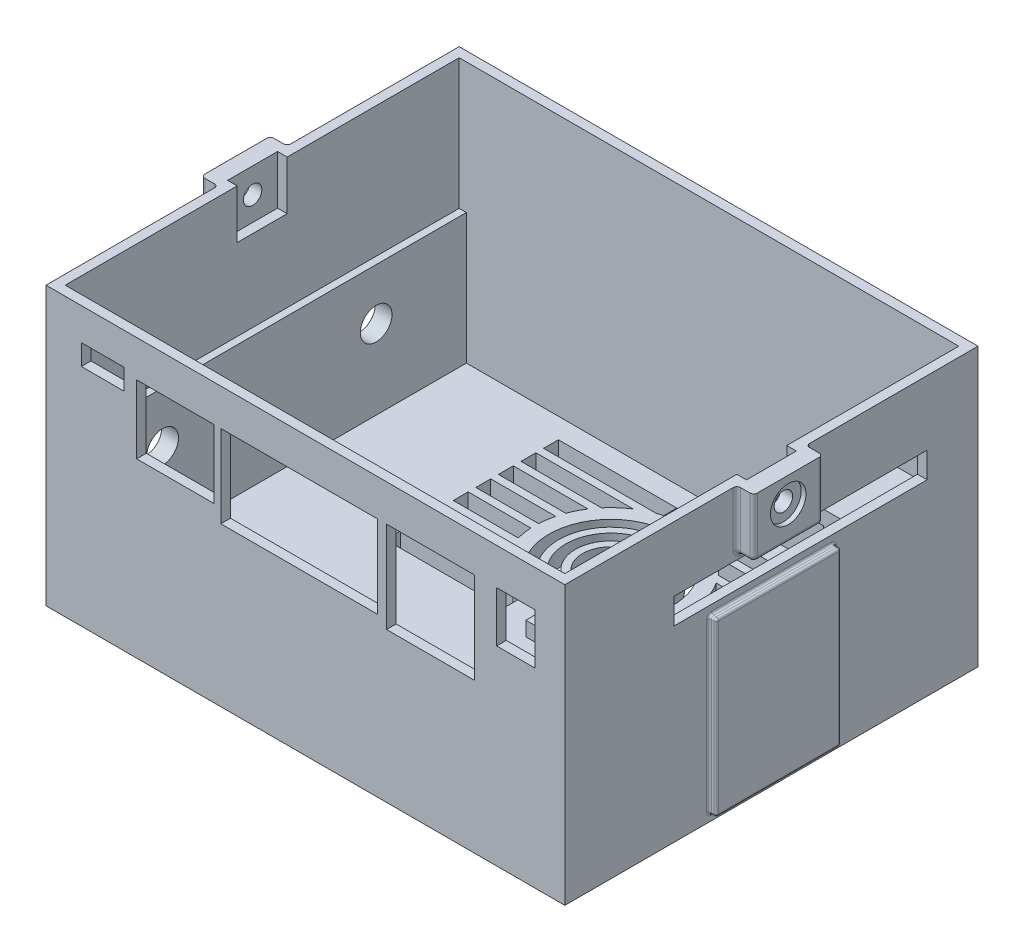
from build123d import *

# Parameters (mm, degrees)
SKETCH1_W                 = 108
SKETCH1_H                 = 86
BOSS_EXTRUDE1_DEPTH       = 1.5
SKETCH2_W                 = 108
SKETCH2_H                 = 86
BOSS_EXTRUDE2_DEPTH       = 56.3
SHELL1_T                  = -2
SHELL1_THICKNESS_2_FACE_W = 82
SHELL1_THICKNESS_2_FACE_H = 104
SHELL1_THICKNESS_2_DEPTH  = 1.5
SKETCH3_W                 = 10.4
SKETCH3_H                 = 10.2125
CUT_EXTRUDE1_DEPTH        = 130.822340142
SKETCH4_W                 = 14.4
SKETCH4_H                 = 12.2125
BOSS_EXTRUDE3_DEPTH       = 3.5
SKETCH5_R                 = 1.925
CUT_EXTRUDE2_DEPTH        = 136.701289603
FILLET1_R                 = 0.75
FILLET2_R                 = 0.75
FILLET3_R                 = 0.75
FILLET4_R                 = 0.75
FILLET5_R                 = 0.75
FILLET6_R                 = 0.75
FILLET7_R                 = 0.75
FILLET8_R                 = 0.75
SKETCH6_W                 = 22
SKETCH6_H                 = 31.76
CUT_EXTRUDE3_DEPTH        = 1.5
SKETCH7_W                 = 26
SKETCH7_H                 = 35.76
BOSS_EXTRUDE4_DEPTH       = 1.5
FILLET9_R                 = 0.5
FILLET10_R                = 0.5
FILLET11_R                = 0.5
FILLET12_R                = 0.5
FILLET13_R                = 0.5
CUT_EXTRUDE4_REACH        = 134.748
SKETCH8_R                 = 3.3
SKETCH9_R                 = 7.7
CUT_EXTRUDE5_DEPTH        = 1.5
SKETCH10_R                = 1
CUT_EXTRUDE7_DEPTH        = 3.5
CHAMFER1_SIZE             = 1.2
CUT_EXTRUDE14_REACH       = 134.748
SKETCH14_W                = 52.66718309
SKETCH14_H                = 5.352161992
SKETCH15_R                = 3.7
CUT_EXTRUDE15_DEPTH       = 1
SKETCH16_W                = 15.24
SKETCH16_H                = 3
BOSS_EXTRUDE5_DEPTH       = 16
SKETCH17_W                = 5
SKETCH17_H                = 15.24
BOSS_EXTRUDE6_DEPTH       = 5
SKETCH19_W                = 82
SKETCH19_H                = 27.15
BOSS_EXTRUDE7_DEPTH       = 1.5
CUT_EXTRUDE16_REACH       = 86.179
SKETCH20_W                = 5.5
SKETCH20_H                = 15.24
CHAMFER2_SIZE             = 1
SKETCH21_W                = 2.5
SKETCH21_H                = 7.5
BOSS_EXTRUDE8_DEPTH       = 2
CHAMFER3_SIZE             = 0.75
CUT_EXTRUDE17_REACH       = 120.504
SKETCH22_W                = 8
SKETCH22_H                = 10.5
SKETCH22_W_2              = 8.895326338
SKETCH22_H_2              = 4.310523948
SKETCH22_W_3              = 16.064987835
SKETCH22_H_3              = 14.242562804
SKETCH22_W_4              = 32.602638297
SKETCH22_H_4              = 17.185035412
SKETCH22_W_5              = 18.335686492
SKETCH22_H_5              = 18.996886161
CUT_EXTRUDE18_REACH       = 94.174
CUT_EXTRUDE19_REACH       = 133.073
SKETCH24_R                = 3.3


with BuildPart() as part:
    # Sketch1 → Boss-Extrude1 (new body)
    with BuildSketch(Plane(origin=(0, 0, 0), x_dir=(1, 0, 0), z_dir=(0, 1, 0))):
        Rectangle(SKETCH1_W, SKETCH1_H)
    extrude(amount=BOSS_EXTRUDE1_DEPTH)

    # Sketch2 → Boss-Extrude2 (add)
    with BuildSketch(Plane(origin=(0, 1.5, 0), x_dir=(1, 0, 0), z_dir=(0, 1, 0))):
        Rectangle(SKETCH2_W, SKETCH2_H)
    extrude(amount=BOSS_EXTRUDE2_DEPTH)

    # Shell1
    shell1_openings = [part.faces().sort_by_distance(p)[0] for p in [
        (0, 57.8, 0),
    ]]
    offset(amount=SHELL1_T, openings=shell1_openings, kind=Kind.INTERSECTION)

    # Shell1 thickness 2 face (on inner face of the shell) → Shell1 thickness 2 (add)
    with BuildSketch(Plane(origin=(0, 2, 0), x_dir=(0, 0, -1), z_dir=(0, -1, 0))):
        Rectangle(SHELL1_THICKNESS_2_FACE_W, SHELL1_THICKNESS_2_FACE_H)
    extrude(amount=-SHELL1_THICKNESS_2_DEPTH)

    # Sketch3 → Cut-Extrude1 (cut, through all)
    with BuildSketch(Plane(origin=(54, 0, 0), x_dir=(0, 0, -1), z_dir=(1, 0, 0))):
        with Locations((0, 52.69375)):
            Rectangle(SKETCH3_W, SKETCH3_H)
    extrude(amount=-CUT_EXTRUDE1_DEPTH, mode=Mode.SUBTRACT)

    # Sketch4 → Boss-Extrude3 (add)
    with BuildSketch(Plane(origin=(54, 0, 0), x_dir=(0, 0, -1), z_dir=(1, 0, 0))):
        with Locations((0, 51.69375)):
            Rectangle(SKETCH4_W, SKETCH4_H)
    boss_extrude3 = extrude(amount=BOSS_EXTRUDE3_DEPTH)

    # Mirror1: Boss-Extrude3 across plane
    add(boss_extrude3.mirror(Plane(origin=(0, 0, 0), x_dir=(0, 0, 1), z_dir=(1, 0, 0))))

    # Sketch5 → Cut-Extrude2 (cut, through all)
    with BuildSketch(Plane(origin=(57.5, 0, 0), x_dir=(0, 0, -1), z_dir=(1, 0, 0))):
        with Locations((0, 52.5875)):
            Circle(SKETCH5_R)
    extrude(amount=-CUT_EXTRUDE2_DEPTH, mode=Mode.SUBTRACT)

    # Fillet1
    fillet1_edges = [part.edges().sort_by_distance(p)[0] for p in [
        (57.5, 51.69375, 7.2),
    ]]
    fillet(fillet1_edges, radius=FILLET1_R)

    # Fillet2
    fillet2_edges = [part.edges().sort_by_distance(p)[0] for p in [
        (55.375, 45.5875, 7.2),
        (57.5, 45.5875, -0.375),
        (57.280330086, 45.5875, 6.980330086),
    ]]
    fillet(fillet2_edges, radius=FILLET2_R)

    # Fillet3
    fillet3_edges = [part.edges().sort_by_distance(p)[0] for p in [
        (55.375, 45.5875, -7.2),
        (57.5, 52.06875, -7.2),
        (57.280330086, 45.807169914, -7.2),
    ]]
    fillet(fillet3_edges, radius=FILLET3_R)

    # Fillet4
    fillet4_edges = [part.edges().sort_by_distance(p)[0] for p in [
        (54, 45.5875, 0),
        (54, 45.807169914, 6.980330086),
        (54, 52.06875, -7.2),
        (54, 45.807169914, -6.980330086),
        (54, 52.06875, 7.2),
    ]]
    fillet(fillet4_edges, radius=FILLET4_R)

    # Fillet5
    fillet5_edges = [part.edges().sort_by_distance(p)[0] for p in [
        (-57.5, 51.69375, -7.2),
    ]]
    fillet(fillet5_edges, radius=FILLET5_R)

    # Fillet6
    fillet6_edges = [part.edges().sort_by_distance(p)[0] for p in [
        (-55.375, 45.5875, -7.2),
        (-57.280330086, 45.5875, -6.980330086),
        (-57.5, 45.5875, 0.375),
    ]]
    fillet(fillet6_edges, radius=FILLET6_R)

    # Fillet7
    fillet7_edges = [part.edges().sort_by_distance(p)[0] for p in [
        (-55.375, 45.5875, 7.2),
        (-57.280330086, 45.807169914, 7.2),
        (-57.5, 52.06875, 7.2),
    ]]
    fillet(fillet7_edges, radius=FILLET7_R)

    # Fillet8
    fillet8_edges = [part.edges().sort_by_distance(p)[0] for p in [
        (-54, 52.06875, -7.2),
        (-54, 45.807169914, -6.980330086),
        (-54, 45.5875, 0),
        (-54, 45.807169914, 6.980330086),
        (-54, 52.06875, 7.2),
    ]]
    fillet(fillet8_edges, radius=FILLET8_R)

    # Sketch6 → Cut-Extrude3 (cut)
    with BuildSketch(Plane.ZY.offset(-52)):
        with Locations((0, 19.38)):
            Rectangle(SKETCH6_W, SKETCH6_H)
    extrude(amount=-CUT_EXTRUDE3_DEPTH, mode=Mode.SUBTRACT)

    # Sketch7 → Boss-Extrude4 (add)
    with BuildSketch(Plane(origin=(54, 0, 0), x_dir=(0, 0, -1), z_dir=(1, 0, 0))):
        with Locations((0, 19.38)):
            Rectangle(SKETCH7_W, SKETCH7_H)
    extrude(amount=BOSS_EXTRUDE4_DEPTH)

    # Fillet9
    fillet9_edges = [part.edges().sort_by_distance(p)[0] for p in [
        (55.5, 19.38, 13),
    ]]
    fillet(fillet9_edges, radius=FILLET9_R)

    # Fillet10
    fillet10_edges = [part.edges().sort_by_distance(p)[0] for p in [
        (54.5, 1.5, 13),
        (55.5, 1.5, -0.25),
        (55.353553391, 1.5, 12.853553391),
    ]]
    fillet(fillet10_edges, radius=FILLET10_R)

    # Fillet11
    fillet11_edges = [part.edges().sort_by_distance(p)[0] for p in [
        (54.5, 1.5, -13),
        (55.5, 19.63, -13),
        (55.353553391, 1.646446609, -13),
    ]]
    fillet(fillet11_edges, radius=FILLET11_R)

    # Fillet12
    fillet12_edges = [part.edges().sort_by_distance(p)[0] for p in [
        (54.5, 37.26, 13),
        (55.353553391, 37.26, 12.853553391),
        (54.5, 37.26, -13),
        (55.5, 37.26, 0),
        (55.353553391, 37.26, -12.853553391),
    ]]
    fillet(fillet12_edges, radius=FILLET12_R)

    # Fillet13
    fillet13_edges = [part.edges().sort_by_distance(p)[0] for p in [
        (54, 1.5, 0),
        (54, 1.646446609, 12.853553391),
        (54, 19.38, -13),
        (54, 1.646446609, -12.853553391),
        (54, 37.26, 0),
        (54, 19.38, 13),
        (54, 37.113553391, 12.853553391),
        (54, 37.113553391, -12.853553391),
    ]]
    fillet(fillet13_edges, radius=FILLET13_R)

    # Sketch8 → Cut-Extrude4 (cut, up to next)
    with BuildSketch(Plane.ZY.offset(54), mode=Mode.PRIVATE) as cut_extrude4_sk1:
        with Locations((-22.225, 20)):
            Circle(SKETCH8_R)
    cut_extrude4_tool1 = extrude(cut_extrude4_sk1.sketch, amount=-CUT_EXTRUDE4_REACH, mode=Mode.PRIVATE) & part.part
    # Sketch8 → Cut-Extrude4 (cut, up to next)
    with BuildSketch(Plane.ZY.offset(54), mode=Mode.PRIVATE) as cut_extrude4_sk2:
        with Locations((22.225, 20)):
            Circle(SKETCH8_R)
    cut_extrude4_tool2 = extrude(cut_extrude4_sk2.sketch, amount=-CUT_EXTRUDE4_REACH, mode=Mode.PRIVATE) & part.part
    add(cut_extrude4_tool1.solids().sort_by_distance((-54, 20, -22.225))[0], mode=Mode.SUBTRACT)
    add(cut_extrude4_tool2.solids().sort_by_distance((-54, 20, 22.225))[0], mode=Mode.SUBTRACT)

    # Sketch9 → Cut-Extrude5 (cut)
    with BuildSketch(Plane(origin=(0, 3.5, 0), x_dir=(1, 0, 0), z_dir=(0, 1, 0))):
        with Locations(Location((42.9999, 0, 0), (0, 0, 270))):
            Circle(SKETCH9_R)
    extrude(amount=-CUT_EXTRUDE5_DEPTH, mode=Mode.SUBTRACT)

    # Sketch10 → Cut-Extrude7 (cut)
    with BuildSketch(Plane.XZ):
        with Locations(Location((34.9999, -8, 0), (0, 0, 270))):
            Circle(SKETCH10_R)
        with Locations(Location((34.9999, 8, 0), (0, 0, 270))):
            Circle(SKETCH10_R)
        with Locations(Location((50.9999, 8, 0), (0, 0, 270))):
            Circle(SKETCH10_R)
        with Locations(Location((50.9999, -8, 0), (0, 0, 270))):
            Circle(SKETCH10_R)
    extrude(amount=-CUT_EXTRUDE7_DEPTH, mode=Mode.SUBTRACT)

    # Chamfer1
    chamfer1_edges = [part.edges().sort_by_distance(p)[0] for p in [
        (50.9999, 0, -7),
        (50.9999, 0, 9),
        (34.9999, 0, 9),
        (34.9999, 0, -7),
    ]]
    chamfer(chamfer1_edges, length=CHAMFER1_SIZE)

    # Sketch14 → Cut-Extrude14 (cut, up to next)
    with BuildSketch(Plane(origin=(54, 0, 0), x_dir=(0, 0, -1), z_dir=(1, 0, 0)), mode=Mode.PRIVATE) as cut_extrude14_sk1:
        with Locations((6.093499001, 41.681814934)):
            Rectangle(SKETCH14_W, SKETCH14_H)
    cut_extrude14_tool1 = extrude(cut_extrude14_sk1.sketch, amount=-CUT_EXTRUDE14_REACH, mode=Mode.PRIVATE) & part.part
    add(cut_extrude14_tool1.solids().sort_by_distance((54, 41.681815, -6.093499))[0], mode=Mode.SUBTRACT)

    # Sketch15 → Cut-Extrude15 (cut)
    with BuildSketch(Plane(origin=(57.5, 0, 0), x_dir=(0, 0, -1), z_dir=(1, 0, 0))):
        with Locations((0, 52.5875)):
            Circle(SKETCH15_R)
    cut_extrude15 = extrude(amount=-CUT_EXTRUDE15_DEPTH, mode=Mode.SUBTRACT)

    # Mirror2: Cut-Extrude15 across plane
    add(cut_extrude15.mirror(Plane(origin=(0, 0, 0), x_dir=(0, 0, 1), z_dir=(1, 0, 0))), mode=Mode.SUBTRACT)

    # Sketch16 → Boss-Extrude5 (add)
    with BuildSketch(Plane.ZY.offset(-52)):
        with Locations((-25.50005, 35.96)):
            Rectangle(SKETCH16_W, SKETCH16_H)
        with Locations((-25.50005, 12.358309837)):
            Rectangle(SKETCH16_W, SKETCH16_H)
        with Locations((25.50005, 12.358309837)):
            Rectangle(SKETCH16_W, SKETCH16_H)
        with Locations((25.50005, 35.96)):
            Rectangle(SKETCH16_W, SKETCH16_H)
    extrude(amount=BOSS_EXTRUDE5_DEPTH)

    # Sketch17 → Boss-Extrude6 (add)
    with BuildSketch(Plane(origin=(0, 13.858309837, 0), x_dir=(1, 0, 0), z_dir=(0, 1, 0))):
        with Locations((49.5, 25.50005)):
            Rectangle(SKETCH17_W, SKETCH17_H)
        with Locations((49.5, -25.50005)):
            Rectangle(SKETCH17_W, SKETCH17_H)
    boss_extrude6 = extrude(amount=BOSS_EXTRUDE6_DEPTH)

    # Mirror3: Boss-Extrude6 across plane
    add(boss_extrude6.mirror(Plane.ZX.offset(24.159154919)))

    # Sketch19 → Boss-Extrude7 (add)
    with BuildSketch(Plane(origin=(-52, 0, 0), x_dir=(0, 0, -1), z_dir=(1, 0, 0))):
        with Locations((0, 17.075)):
            Rectangle(SKETCH19_W, SKETCH19_H)
    extrude(amount=BOSS_EXTRUDE7_DEPTH)

    # Sketch20 → Cut-Extrude16 (cut, up to next)
    with BuildSketch(Plane(origin=(0, 13.858309837, 0), x_dir=(1, 0, 0), z_dir=(0, 1, 0)), mode=Mode.PRIVATE) as cut_extrude16_sk1:
        with Locations((38.75, -25.50005)):
            Rectangle(SKETCH20_W, SKETCH20_H)
    cut_extrude16_tool1 = extrude(cut_extrude16_sk1.sketch, amount=-CUT_EXTRUDE16_REACH, mode=Mode.PRIVATE) & part.part
    # Sketch20 → Cut-Extrude16 (cut, up to next)
    with BuildSketch(Plane(origin=(0, 13.858309837, 0), x_dir=(1, 0, 0), z_dir=(0, 1, 0)), mode=Mode.PRIVATE) as cut_extrude16_sk2:
        with Locations((38.75, 25.50005)):
            Rectangle(SKETCH20_W, SKETCH20_H)
    cut_extrude16_tool2 = extrude(cut_extrude16_sk2.sketch, amount=-CUT_EXTRUDE16_REACH, mode=Mode.PRIVATE) & part.part
    add(cut_extrude16_tool1.solids().sort_by_distance((38.75, 13.85831, 25.50005))[0], mode=Mode.SUBTRACT)
    add(cut_extrude16_tool2.solids().sort_by_distance((38.75, 13.85831, -25.50005))[0], mode=Mode.SUBTRACT)

    # Chamfer2
    chamfer2_edges = [part.edges().sort_by_distance(p)[0] for p in [
        (41.5, 13.858309837, 25.50005),
        (41.5, 13.858309837, -25.50005),
    ]]
    chamfer(chamfer2_edges, length=CHAMFER2_SIZE)

    # Sketch21 → Boss-Extrude8 (add)
    with BuildSketch(Plane.XZ.offset(-34.46)):
        with Locations((41.25, 25.552322756)):
            Rectangle(SKETCH21_W, SKETCH21_H)
        with Locations((41.25, -25.55005)):
            Rectangle(SKETCH21_W, SKETCH21_H)
    extrude(amount=BOSS_EXTRUDE8_DEPTH)

    # Chamfer3
    chamfer3_edges = [part.edges().sort_by_distance(p)[0] for p in [
        (42.5, 32.46, 25.552322756),
        (42.5, 32.46, -25.55005),
    ]]
    chamfer(chamfer3_edges, length=CHAMFER3_SIZE)

    # Sketch22 → Cut-Extrude17 (cut, up to next)
    with BuildSketch(Plane.XY.offset(43), mode=Mode.PRIVATE) as cut_extrude17_sk1:
        with Locations((43.8, 44.9175)):
            Rectangle(SKETCH22_W, SKETCH22_H)
    cut_extrude17_tool1 = extrude(cut_extrude17_sk1.sketch, amount=-CUT_EXTRUDE17_REACH, mode=Mode.PRIVATE) & part.part
    # Sketch22 → Cut-Extrude17 (cut, up to next)
    with BuildSketch(Plane.XY.offset(43), mode=Mode.PRIVATE) as cut_extrude17_sk2:
        with Locations((-42.207453176, 48.971151447)):
            Rectangle(SKETCH22_W_2, SKETCH22_H_2)
    cut_extrude17_tool2 = extrude(cut_extrude17_sk2.sketch, amount=-CUT_EXTRUDE17_REACH, mode=Mode.PRIVATE) & part.part
    # Sketch22 → Cut-Extrude17 (cut, up to next)
    with BuildSketch(Plane.XY.offset(43), mode=Mode.PRIVATE) as cut_extrude17_sk3:
        with Locations((-27.10191402, 43.046218598)):
            Rectangle(SKETCH22_W_3, SKETCH22_H_3)
    cut_extrude17_tool3 = extrude(cut_extrude17_sk3.sketch, amount=-CUT_EXTRUDE17_REACH, mode=Mode.PRIVATE) & part.part
    # Sketch22 → Cut-Extrude17 (cut, up to next)
    with BuildSketch(Plane.XY.offset(43), mode=Mode.PRIVATE) as cut_extrude17_sk4:
        with Locations((-1.310490325, 41.574982294)):
            Rectangle(SKETCH22_W_4, SKETCH22_H_4)
    cut_extrude17_tool4 = extrude(cut_extrude17_sk4.sketch, amount=-CUT_EXTRUDE17_REACH, mode=Mode.PRIVATE) & part.part
    # Sketch22 → Cut-Extrude17 (cut, up to next)
    with BuildSketch(Plane.XY.offset(43), mode=Mode.PRIVATE) as cut_extrude17_sk5:
        with Locations((26.052494525, 40.66905692)):
            Rectangle(SKETCH22_W_5, SKETCH22_H_5)
    cut_extrude17_tool5 = extrude(cut_extrude17_sk5.sketch, amount=-CUT_EXTRUDE17_REACH, mode=Mode.PRIVATE) & part.part
    add(cut_extrude17_tool1.solids().sort_by_distance((43.8, 44.9175, 43))[0], mode=Mode.SUBTRACT)
    add(cut_extrude17_tool2.solids().sort_by_distance((-42.207453, 48.971151, 43))[0], mode=Mode.SUBTRACT)
    add(cut_extrude17_tool3.solids().sort_by_distance((-27.101914, 43.046219, 43))[0], mode=Mode.SUBTRACT)
    add(cut_extrude17_tool4.solids().sort_by_distance((-1.31049, 41.574982, 43))[0], mode=Mode.SUBTRACT)
    add(cut_extrude17_tool5.solids().sort_by_distance((26.052495, 40.669057, 43))[0], mode=Mode.SUBTRACT)

    # Sketch23 → Cut-Extrude18 (cut, up to next)
    with BuildSketch(Plane.XZ, mode=Mode.PRIVATE) as cut_extrude18_sk1:
        with BuildLine():
            Line((19.463521733, -13.275), (16.682263194, -13.275))
            ThreePointArc((16.682263194, -13.275), (15.992578589, -11.682576523), (15.133107582, -10.175))
            Line((15.133107582, -10.175), (30.7, -10.175))
            Line((30.7, -10.175), (30.7, -13.275))
            Line((30.7, -13.275), (19.463521733, -13.275))
        make_face()
    cut_extrude18_tool1 = extrude(cut_extrude18_sk1.sketch, amount=-CUT_EXTRUDE18_REACH, mode=Mode.PRIVATE) & part.part
    # Sketch23 → Cut-Extrude18 (cut, up to next)
    with BuildSketch(Plane.XZ, mode=Mode.PRIVATE) as cut_extrude18_sk2:
        with BuildLine():
            Line((19.884247289, -14.875), (17.17926389, -14.875))
            ThreePointArc((17.17926389, -14.875), (17.489322047, -16.413447226), (17.645875103, -17.975))
            Line((17.645875103, -17.975), (30.7, -17.975))
            Line((30.7, -17.975), (30.7, -14.875))
            Line((30.7, -14.875), (19.884247289, -14.875))
        make_face()
    cut_extrude18_tool2 = extrude(cut_extrude18_sk2.sketch, amount=-CUT_EXTRUDE18_REACH, mode=Mode.PRIVATE) & part.part
    # Sketch23 → Cut-Extrude18 (cut, up to next)
    with BuildSketch(Plane.XZ, mode=Mode.PRIVATE) as cut_extrude18_sk3:
        with BuildLine():
            Line((19.884247289, -22.675), (17.17926389, -22.675))
            ThreePointArc((17.17926389, -22.675), (17.489322047, -21.136552774), (17.645875103, -19.575))
            Line((17.645875103, -19.575), (30.7, -19.575))
            Line((30.7, -19.575), (30.7, -22.675))
            Line((30.7, -22.675), (19.884247289, -22.675))
        make_face()
    cut_extrude18_tool3 = extrude(cut_extrude18_sk3.sketch, amount=-CUT_EXTRUDE18_REACH, mode=Mode.PRIVATE) & part.part
    # Sketch23 → Cut-Extrude18 (cut, up to next)
    with BuildSketch(Plane.XZ, mode=Mode.PRIVATE) as cut_extrude18_sk4:
        with BuildLine():
            Line((19.463521733, -24.275), (16.682263194, -24.275))
            ThreePointArc((16.682263194, -24.275), (15.992578589, -25.867423477), (15.133107582, -27.375))
            Line((15.133107582, -27.375), (30.7, -27.375))
            Line((30.7, -27.375), (30.7, -24.275))
            Line((30.7, -24.275), (19.463521733, -24.275))
        make_face()
    cut_extrude18_tool4 = extrude(cut_extrude18_sk4.sketch, amount=-CUT_EXTRUDE18_REACH, mode=Mode.PRIVATE) & part.part
    # Sketch23 → Cut-Extrude18 (cut, up to next)
    with BuildSketch(Plane.XZ, mode=Mode.PRIVATE) as cut_extrude18_sk5:
        with BuildLine():
            Line((-15.863521733, -13.275), (-13.082263194, -13.275))
            ThreePointArc((-13.082263194, -13.275), (-12.392578589, -11.682576523), (-11.533107582, -10.175))
            Line((-11.533107582, -10.175), (-27.1, -10.175))
            Line((-27.1, -10.175), (-27.1, -13.275))
            Line((-27.1, -13.275), (-15.863521733, -13.275))
        make_face()
    cut_extrude18_tool5 = extrude(cut_extrude18_sk5.sketch, amount=-CUT_EXTRUDE18_REACH, mode=Mode.PRIVATE) & part.part
    # Sketch23 → Cut-Extrude18 (cut, up to next)
    with BuildSketch(Plane.XZ, mode=Mode.PRIVATE) as cut_extrude18_sk6:
        with BuildLine():
            Line((-16.284247289, -14.875), (-13.57926389, -14.875))
            ThreePointArc((-13.57926389, -14.875), (-13.889322047, -16.413447226), (-14.045875103, -17.975))
            Line((-14.045875103, -17.975), (-27.1, -17.975))
            Line((-27.1, -17.975), (-27.1, -14.875))
            Line((-27.1, -14.875), (-16.284247289, -14.875))
        make_face()
    cut_extrude18_tool6 = extrude(cut_extrude18_sk6.sketch, amount=-CUT_EXTRUDE18_REACH, mode=Mode.PRIVATE) & part.part
    # Sketch23 → Cut-Extrude18 (cut, up to next)
    with BuildSketch(Plane.XZ, mode=Mode.PRIVATE) as cut_extrude18_sk7:
        with BuildLine():
            Line((-16.284247289, -22.675), (-13.57926389, -22.675))
            ThreePointArc((-13.57926389, -22.675), (-13.889322047, -21.136552774), (-14.045875103, -19.575))
            Line((-14.045875103, -19.575), (-27.1, -19.575))
            Line((-27.1, -19.575), (-27.1, -22.675))
            Line((-27.1, -22.675), (-16.284247289, -22.675))
        make_face()
    cut_extrude18_tool7 = extrude(cut_extrude18_sk7.sketch, amount=-CUT_EXTRUDE18_REACH, mode=Mode.PRIVATE) & part.part
    # Sketch23 → Cut-Extrude18 (cut, up to next)
    with BuildSketch(Plane.XZ, mode=Mode.PRIVATE) as cut_extrude18_sk8:
        with BuildLine():
            Line((-15.863521733, -24.275), (-13.082263194, -24.275))
            ThreePointArc((-13.082263194, -24.275), (-12.392578589, -25.867423477), (-11.533107582, -27.375))
            Line((-11.533107582, -27.375), (-27.1, -27.375))
            Line((-27.1, -27.375), (-27.1, -24.275))
            Line((-27.1, -24.275), (-15.863521733, -24.275))
        make_face()
    cut_extrude18_tool8 = extrude(cut_extrude18_sk8.sketch, amount=-CUT_EXTRUDE18_REACH, mode=Mode.PRIVATE) & part.part
    # Sketch23 → Cut-Extrude18 (cut, up to next)
    with BuildSketch(Plane.XZ, mode=Mode.PRIVATE) as cut_extrude18_sk9:
        with BuildLine():
            Line((1, -14.982448083), (1, -12.953703903))
            ThreePointArc((1, -12.953703903), (-4.076009551, -18.775), (1, -24.596296097))
            Line((1, -24.596296097), (1, -22.567551917))
            ThreePointArc((1, -22.567551917), (-2.076009551, -18.775), (1, -14.982448083))
        make_face()
    cut_extrude18_tool9 = extrude(cut_extrude18_sk9.sketch, amount=-CUT_EXTRUDE18_REACH, mode=Mode.PRIVATE) & part.part
    # Sketch23 → Cut-Extrude18 (cut, up to next)
    with BuildSketch(Plane.XZ, mode=Mode.PRIVATE) as cut_extrude18_sk10:
        with BuildLine():
            Line((1, -31.6261331), (1, -29.621547089))
            ThreePointArc((1, -29.621547089), (-9.076009551, -18.775), (1, -7.928452911))
            Line((1, -7.928452911), (1, -5.9238669))
            ThreePointArc((1, -5.9238669), (-7.852808786, -10.253562064), (-11.0511331, -19.575))
            ThreePointArc((-11.0511331, -19.575), (-8.470694953, -26.540593804), (-2.472001873, -30.92167123))
            ThreePointArc((-2.472001873, -30.92167123), (-0.760345168, -31.393884839), (1, -31.6261331))
        make_face()
    cut_extrude18_tool10 = extrude(cut_extrude18_sk10.sketch, amount=-CUT_EXTRUDE18_REACH, mode=Mode.PRIVATE) & part.part
    # Sketch23 → Cut-Extrude18 (cut, up to next)
    with BuildSketch(Plane.XZ, mode=Mode.PRIVATE) as cut_extrude18_sk11:
        with BuildLine():
            Line((2.6, -31.6261331), (2.6, -29.621547089))
            ThreePointArc((2.6, -29.621547089), (12.676009551, -18.775), (2.6, -7.928452911))
            Line((2.6, -7.928452911), (2.6, -5.9238669))
            ThreePointArc((2.6, -5.9238669), (4.360345168, -6.156115161), (6.072001873, -6.62832877))
            ThreePointArc((6.072001873, -6.62832877), (12.070694953, -11.009406196), (14.6511331, -17.975))
            ThreePointArc((14.6511331, -17.975), (11.452808786, -27.296437936), (2.6, -31.6261331))
        make_face()
    cut_extrude18_tool11 = extrude(cut_extrude18_sk11.sketch, amount=-CUT_EXTRUDE18_REACH, mode=Mode.PRIVATE) & part.part
    # Sketch23 → Cut-Extrude18 (cut, up to next)
    with BuildSketch(Plane.XZ, mode=Mode.PRIVATE) as cut_extrude18_sk12:
        with BuildLine():
            Line((6.072001873, -0.775), (6.072001873, -3.494890125))
            ThreePointArc((6.072001873, -3.494890125), (6.66559746, -3.673419978), (7.251766483, -3.875))
            Line((7.251766483, -3.875), (30.7, -3.875))
            Line((30.7, -3.875), (30.7, -0.775))
            Line((30.7, -0.775), (6.072001873, -0.775))
        make_face()
    cut_extrude18_tool12 = extrude(cut_extrude18_sk12.sketch, amount=-CUT_EXTRUDE18_REACH, mode=Mode.PRIVATE) & part.part
    # Sketch23 → Cut-Extrude18 (cut, up to next)
    with BuildSketch(Plane.XZ, mode=Mode.PRIVATE) as cut_extrude18_sk13:
        with BuildLine():
            Line((-2.472001873, -36.775), (-2.472001873, -34.055109875))
            ThreePointArc((-2.472001873, -34.055109875), (-3.06559746, -33.876580022), (-3.651766483, -33.675))
            Line((-3.651766483, -33.675), (-27.1, -33.675))
            Line((-27.1, -33.675), (-27.1, -36.775))
            Line((-27.1, -36.775), (-2.472001873, -36.775))
        make_face()
    cut_extrude18_tool13 = extrude(cut_extrude18_sk13.sketch, amount=-CUT_EXTRUDE18_REACH, mode=Mode.PRIVATE) & part.part
    # Sketch23 → Cut-Extrude18 (cut, up to next)
    with BuildSketch(Plane.XZ, mode=Mode.PRIVATE) as cut_extrude18_sk14:
        with BuildLine():
            Line((6.072001873, -34.055109875), (6.072001873, -36.775))
            Line((6.072001873, -36.775), (30.7, -36.775))
            Line((30.7, -36.775), (30.7, -33.675))
            Line((30.7, -33.675), (7.251766483, -33.675))
            ThreePointArc((7.251766483, -33.675), (6.66559746, -33.876580022), (6.072001873, -34.055109875))
        make_face()
    cut_extrude18_tool14 = extrude(cut_extrude18_sk14.sketch, amount=-CUT_EXTRUDE18_REACH, mode=Mode.PRIVATE) & part.part
    # Sketch23 → Cut-Extrude18 (cut, up to next)
    with BuildSketch(Plane.XZ, mode=Mode.PRIVATE) as cut_extrude18_sk15:
        with BuildLine():
            Line((-2.472001873, -3.494890125), (-2.472001873, -0.775))
            Line((-2.472001873, -0.775), (-27.1, -0.775))
            Line((-27.1, -0.775), (-27.1, -3.875))
            Line((-27.1, -3.875), (-3.651766483, -3.875))
            ThreePointArc((-3.651766483, -3.875), (-3.06559746, -3.673419978), (-2.472001873, -3.494890125))
        make_face()
    cut_extrude18_tool15 = extrude(cut_extrude18_sk15.sketch, amount=-CUT_EXTRUDE18_REACH, mode=Mode.PRIVATE) & part.part
    # Sketch23 → Cut-Extrude18 (cut, up to next)
    with BuildSketch(Plane.XZ, mode=Mode.PRIVATE) as cut_extrude18_sk16:
        with BuildLine():
            Line((2.6, -14.982448083), (2.6, -12.953703903))
            ThreePointArc((2.6, -12.953703903), (7.676009551, -18.775), (2.6, -24.596296097))
            Line((2.6, -24.596296097), (2.6, -22.567551917))
            ThreePointArc((2.6, -22.567551917), (5.676009551, -18.775), (2.6, -14.982448083))
        make_face()
    cut_extrude18_tool16 = extrude(cut_extrude18_sk16.sketch, amount=-CUT_EXTRUDE18_REACH, mode=Mode.PRIVATE) & part.part
    # Sketch23 → Cut-Extrude18 (cut, up to next)
    with BuildSketch(Plane.XZ, mode=Mode.PRIVATE) as cut_extrude18_sk17:
        with BuildLine():
            Line((1, -11.442502683), (1, -9.433182452))
            ThreePointArc((1, -9.433182452), (-7.576009551, -18.775), (1, -28.116817548))
            Line((1, -28.116817548), (1, -26.107497317))
            ThreePointArc((1, -26.107497317), (-5.576009551, -18.775), (1, -11.442502683))
        make_face()
    cut_extrude18_tool17 = extrude(cut_extrude18_sk17.sketch, amount=-CUT_EXTRUDE18_REACH, mode=Mode.PRIVATE) & part.part
    # Sketch23 → Cut-Extrude18 (cut, up to next)
    with BuildSketch(Plane.XZ, mode=Mode.PRIVATE) as cut_extrude18_sk18:
        with BuildLine():
            Line((2.6, -11.442502683), (2.6, -9.433182452))
            ThreePointArc((2.6, -9.433182452), (11.176009551, -18.775), (2.6, -28.116817548))
            Line((2.6, -28.116817548), (2.6, -26.107497317))
            ThreePointArc((2.6, -26.107497317), (9.176009551, -18.775), (2.6, -11.442502683))
        make_face()
    cut_extrude18_tool18 = extrude(cut_extrude18_sk18.sketch, amount=-CUT_EXTRUDE18_REACH, mode=Mode.PRIVATE) & part.part
    # Sketch23 → Cut-Extrude18 (cut, up to next)
    with BuildSketch(Plane.XZ, mode=Mode.PRIVATE) as cut_extrude18_sk19:
        with BuildLine():
            Line((-10.352849781, -28.975), (-27.1, -28.975))
            Line((-27.1, -28.975), (-27.1, -32.075))
            Line((-27.1, -32.075), (-6.851113095, -32.075))
            ThreePointArc((-6.851113095, -32.075), (-8.716830218, -30.654732318), (-10.352849781, -28.975))
        make_face()
    cut_extrude18_tool19 = extrude(cut_extrude18_sk19.sketch, amount=-CUT_EXTRUDE18_REACH, mode=Mode.PRIVATE) & part.part
    # Sketch23 → Cut-Extrude18 (cut, up to next)
    with BuildSketch(Plane.XZ, mode=Mode.PRIVATE) as cut_extrude18_sk20:
        with BuildLine():
            Line((10.451113095, -32.075), (30.7, -32.075))
            Line((30.7, -32.075), (30.7, -28.975))
            Line((30.7, -28.975), (13.952849781, -28.975))
            ThreePointArc((13.952849781, -28.975), (12.316830218, -30.654732318), (10.451113095, -32.075))
        make_face()
    cut_extrude18_tool20 = extrude(cut_extrude18_sk20.sketch, amount=-CUT_EXTRUDE18_REACH, mode=Mode.PRIVATE) & part.part
    # Sketch23 → Cut-Extrude18 (cut, up to next)
    with BuildSketch(Plane.XZ, mode=Mode.PRIVATE) as cut_extrude18_sk21:
        with BuildLine():
            Line((13.952849781, -8.575), (30.7, -8.575))
            Line((30.7, -8.575), (30.7, -5.475))
            Line((30.7, -5.475), (10.451113095, -5.475))
            ThreePointArc((10.451113095, -5.475), (12.316830218, -6.895267682), (13.952849781, -8.575))
        make_face()
    cut_extrude18_tool21 = extrude(cut_extrude18_sk21.sketch, amount=-CUT_EXTRUDE18_REACH, mode=Mode.PRIVATE) & part.part
    # Sketch23 → Cut-Extrude18 (cut, up to next)
    with BuildSketch(Plane.XZ, mode=Mode.PRIVATE) as cut_extrude18_sk22:
        with BuildLine():
            Line((-6.851113095, -5.475), (-27.1, -5.475))
            Line((-27.1, -5.475), (-27.1, -8.575))
            Line((-27.1, -8.575), (-10.352849781, -8.575))
            ThreePointArc((-10.352849781, -8.575), (-8.716830218, -6.895267682), (-6.851113095, -5.475))
        make_face()
    cut_extrude18_tool22 = extrude(cut_extrude18_sk22.sketch, amount=-CUT_EXTRUDE18_REACH, mode=Mode.PRIVATE) & part.part
    add(cut_extrude18_tool1.solids().sort_by_distance((23.332443, 0, -11.697897))[0], mode=Mode.SUBTRACT)
    add(cut_extrude18_tool2.solids().sort_by_distance((24.081758, 0, -16.415911))[0], mode=Mode.SUBTRACT)
    add(cut_extrude18_tool3.solids().sort_by_distance((24.081758, 0, -21.134089))[0], mode=Mode.SUBTRACT)
    add(cut_extrude18_tool4.solids().sort_by_distance((23.332443, 0, -25.852103))[0], mode=Mode.SUBTRACT)
    add(cut_extrude18_tool5.solids().sort_by_distance((-19.732443, 0, -11.697897))[0], mode=Mode.SUBTRACT)
    add(cut_extrude18_tool6.solids().sort_by_distance((-20.481758, 0, -16.415911))[0], mode=Mode.SUBTRACT)
    add(cut_extrude18_tool7.solids().sort_by_distance((-20.481758, 0, -21.134089))[0], mode=Mode.SUBTRACT)
    add(cut_extrude18_tool8.solids().sort_by_distance((-19.732443, 0, -25.852103))[0], mode=Mode.SUBTRACT)
    add(cut_extrude18_tool9.solids().sort_by_distance((0.87299, 0, -13.968076))[0], mode=Mode.SUBTRACT)
    add(cut_extrude18_tool10.solids().sort_by_distance((0.716022, 0, -30.62384))[0], mode=Mode.SUBTRACT)
    add(cut_extrude18_tool11.solids().sort_by_distance((11.239918, 0, -27.108499))[0], mode=Mode.SUBTRACT)
    add(cut_extrude18_tool12.solids().sort_by_distance((18.422659, 0, -2.320629))[0], mode=Mode.SUBTRACT)
    add(cut_extrude18_tool13.solids().sort_by_distance((-14.822659, 0, -35.229371))[0], mode=Mode.SUBTRACT)
    add(cut_extrude18_tool14.solids().sort_by_distance((18.422659, 0, -35.229371))[0], mode=Mode.SUBTRACT)
    add(cut_extrude18_tool15.solids().sort_by_distance((-14.822659, 0, -2.320629))[0], mode=Mode.SUBTRACT)
    add(cut_extrude18_tool16.solids().sort_by_distance((2.72701, 0, -13.968076))[0], mode=Mode.SUBTRACT)
    add(cut_extrude18_tool17.solids().sort_by_distance((0.794421, 0, -10.437843))[0], mode=Mode.SUBTRACT)
    add(cut_extrude18_tool18.solids().sort_by_distance((2.805579, 0, -27.112157))[0], mode=Mode.SUBTRACT)
    add(cut_extrude18_tool19.solids().sort_by_distance((-17.910727, 0, -30.573875))[0], mode=Mode.SUBTRACT)
    add(cut_extrude18_tool20.solids().sort_by_distance((21.510727, 0, -30.573875))[0], mode=Mode.SUBTRACT)
    add(cut_extrude18_tool21.solids().sort_by_distance((21.510727, 0, -6.976125))[0], mode=Mode.SUBTRACT)
    add(cut_extrude18_tool22.solids().sort_by_distance((-17.910727, 0, -6.976125))[0], mode=Mode.SUBTRACT)

    # Sketch24 → Cut-Extrude19 (cut, up to next)
    with BuildSketch(Plane.ZY.offset(52), mode=Mode.PRIVATE) as cut_extrude19_sk1:
        with Locations((22.225, 20)):
            Circle(SKETCH24_R)
    cut_extrude19_tool1 = extrude(cut_extrude19_sk1.sketch, amount=-CUT_EXTRUDE19_REACH, mode=Mode.PRIVATE) & part.part
    # Sketch24 → Cut-Extrude19 (cut, up to next)
    with BuildSketch(Plane.ZY.offset(52), mode=Mode.PRIVATE) as cut_extrude19_sk2:
        with Locations((-22.225, 20)):
            Circle(SKETCH24_R)
    cut_extrude19_tool2 = extrude(cut_extrude19_sk2.sketch, amount=-CUT_EXTRUDE19_REACH, mode=Mode.PRIVATE) & part.part
    add(cut_extrude19_tool1.solids().sort_by_distance((-52, 20, 22.225))[0], mode=Mode.SUBTRACT)
    add(cut_extrude19_tool2.solids().sort_by_distance((-52, 20, -22.225))[0], mode=Mode.SUBTRACT)


solid = part.part
